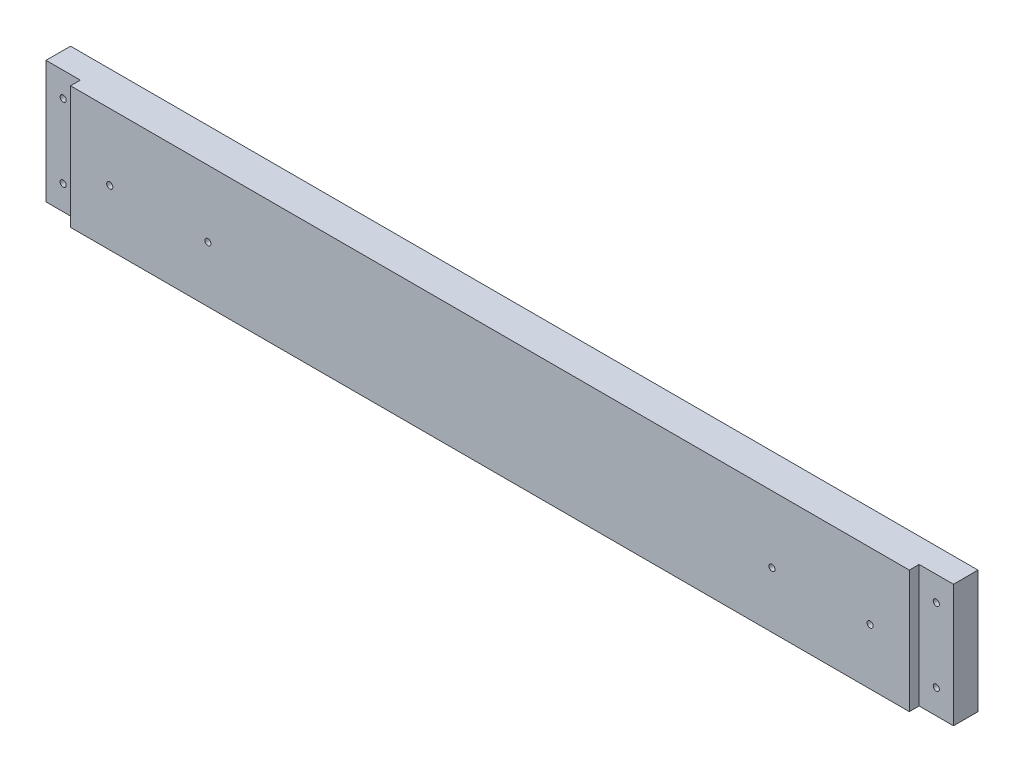
from build123d import *

# Parameters (mm, degrees)
SKETCH2_W          = 469.9
SKETCH2_H          = 63.5
EXTRUDE1_DEPTH     = 17.78
SKETCH3_W          = 17.78
SKETCH3_H          = 63.5
CUT_EXTRUDE1_DEPTH = 5.08
SKETCH4_R          = 1.5875
CUT_EXTRUDE2_DEPTH = 17.78
SKETCH5_R          = 1.5875
CUT_EXTRUDE3_DEPTH = 17.78


with BuildPart() as part:
    # Sketch2 → Extrude1 (new body)
    with BuildSketch(Plane.XY):
        with Locations((11073.341666666, -5688.0125)):
            Rectangle(SKETCH2_W, SKETCH2_H)
    extrude(amount=-EXTRUDE1_DEPTH)

    # Sketch3 → Cut-Extrude1 (cut)
    with BuildSketch(Plane.XY):
        with Locations((11299.401666666, -5688.0125)):
            Rectangle(SKETCH3_W, SKETCH3_H)
        with Locations((10847.281666666, -5688.0125)):
            Rectangle(SKETCH3_W, SKETCH3_H)
    extrude(amount=-CUT_EXTRUDE1_DEPTH, mode=Mode.SUBTRACT)

    # Sketch4 → Cut-Extrude2 (cut)
    with BuildSketch(Plane.XY):
        with Locations((10847.281666666, -5668.9625)):
            Circle(SKETCH4_R)
        with Locations((10847.281666666, -5707.0625)):
            Circle(SKETCH4_R)
        with Locations((11299.401666666, -5707.0625)):
            Circle(SKETCH4_R)
        with Locations((11299.401666666, -5668.9625)):
            Circle(SKETCH4_R)
    extrude(amount=-CUT_EXTRUDE2_DEPTH, mode=Mode.SUBTRACT)

    # Sketch5 → Cut-Extrude3 (cut)
    with BuildSketch(Plane(origin=(0, 0, -17.78), x_dir=(-1, 0, 0), z_dir=(0, 0, -1))):
        with Locations((-10876.491666666, -5690.78745)):
            Circle(SKETCH5_R)
        with Locations((-10927.291666666, -5690.78745)):
            Circle(SKETCH5_R)
        with Locations((-11219.391666666, -5690.78745)):
            Circle(SKETCH5_R)
        with Locations((-11270.191666666, -5690.78745)):
            Circle(SKETCH5_R)
    extrude(amount=-CUT_EXTRUDE3_DEPTH, mode=Mode.SUBTRACT)


solid = part.part
